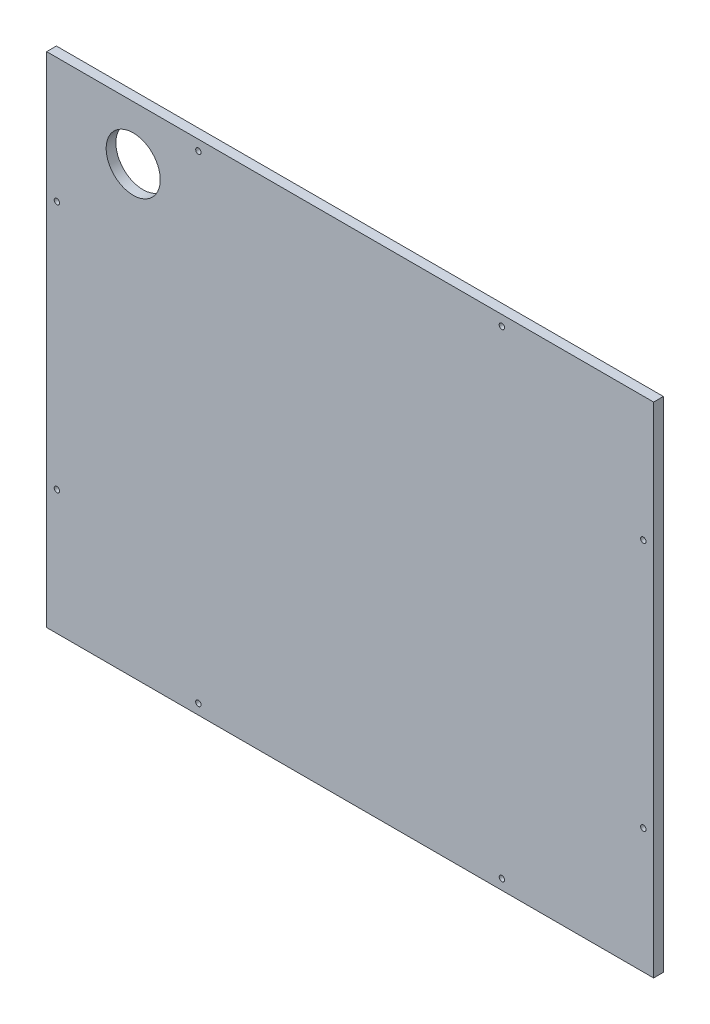
from build123d import *

# Parameters (mm, degrees)
SKETCH_1_W               = 561
SKETCH_1_H               = 461
SKETCH_1_R               = 2.5
EXTRUDE_1_DEPTH          = 9
CUT_EXTRUDE_1_DEPTH      = 540.705706844
CUT_EXTRUDE_1_DEPTH_BACK = 540.705706844
SKETCH_2_R               = 25


with BuildPart() as part:
    # 草图1 → 凸台-拉伸1 (new body)
    with BuildSketch(Plane.XY):
        with Locations((0, 230.5)):
            Rectangle(SKETCH_1_W, SKETCH_1_H)
        with Locations((-140.25, 451.5)):
            Circle(SKETCH_1_R, mode=Mode.SUBTRACT)
        with Locations((-271, 345.75)):
            Circle(SKETCH_1_R, mode=Mode.SUBTRACT)
        with Locations(Location((271, 345.75, 0), (0, 0, 180))):
            Circle(SKETCH_1_R, mode=Mode.SUBTRACT)
        with Locations(Location((140.25, 451.5, 0), (0, 0, 180))):
            Circle(SKETCH_1_R, mode=Mode.SUBTRACT)
        with Locations((271, 115.25)):
            Circle(SKETCH_1_R, mode=Mode.SUBTRACT)
        with Locations((140.25, 9.5)):
            Circle(SKETCH_1_R, mode=Mode.SUBTRACT)
        with Locations(Location((-271, 115.25, 0), (0, 0, 180))):
            Circle(SKETCH_1_R, mode=Mode.SUBTRACT)
        with Locations(Location((-140.25, 9.5, 0), (0, 0, 180))):
            Circle(SKETCH_1_R, mode=Mode.SUBTRACT)
    extrude(amount=EXTRUDE_1_DEPTH)

    # 草图2 → 切除-拉伸1 (cut, two sides: drawn at the far end of the back side and taken through both)
    with BuildSketch(Plane(origin=(0, 0, 0), x_dir=(-1, 0, 0), z_dir=(0, 0, -1)).offset(-CUT_EXTRUDE_1_DEPTH_BACK)):
        with Locations((200.5, 411)):
            Circle(SKETCH_2_R)
    extrude(amount=CUT_EXTRUDE_1_DEPTH + CUT_EXTRUDE_1_DEPTH_BACK, mode=Mode.SUBTRACT)


solid = part.part
